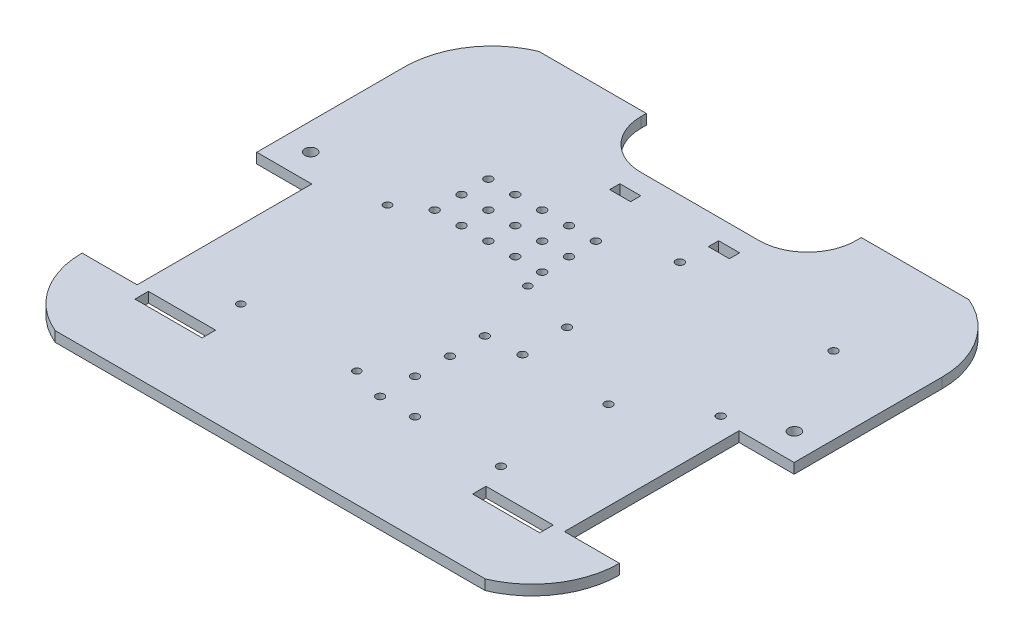
from build123d import *

# Parameters (mm, degrees)
SKETCH1_W           = 254
SKETCH1_H           = 228.6
BOSS_EXTRUDE1_DEPTH = 4.826
SKETCH2_W           = 26.00000007
SKETCH2_H           = 82.55
CUT_EXTRUDE1_DEPTH  = 4.826
CUT_EXTRUDE3_DEPTH  = 4.826
SKETCH7_W           = 50.8
SKETCH7_H           = 25.4
CUT_EXTRUDE5_DEPTH  = 4.826
FILLET9_R           = 22.86
FILLET10_R          = 22.86
CUT_EXTRUDE6_DEPTH  = 4.826
SKETCH9_W           = 31.75
SKETCH9_H           = 6.35
CUT_EXTRUDE7_DEPTH  = 171.929167423
SKETCH11_W          = 9.906
SKETCH11_H          = 4.826
CUT_EXTRUDE8_DEPTH  = 171.929167423
SKETCH13_R          = 1.905
CUT_EXTRUDE10_DEPTH = 171.929167423
SKETCH14_R          = 1.778
CUT_EXTRUDE11_DEPTH = 171.929167423
SKETCH15_R          = 1.905
CUT_EXTRUDE12_DEPTH = 171.929167423
SKETCH16_R          = 1.905
CUT_EXTRUDE13_DEPTH = 171.929167423
SKETCH17_R          = 2.778125
CUT_EXTRUDE14_DEPTH = 171.929167423
SKETCH18_R          = 1.905
CUT_EXTRUDE15_DEPTH = 171.929167423


with BuildPart() as part:
    # Sketch1 → Boss-Extrude1 (new body)
    with BuildSketch(Plane(origin=(0, 0, 0), x_dir=(1, 0, 0), z_dir=(0, 1, 0))):
        Rectangle(SKETCH1_W, SKETCH1_H)
    extrude(amount=BOSS_EXTRUDE1_DEPTH)

    # Sketch2 → Cut-Extrude1 (cut)
    with BuildSketch(Plane(origin=(0, 4.826, 0), x_dir=(1, 0, 0), z_dir=(0, 1, 0))):
        with Locations((-113.999999965, -34.925)):
            Rectangle(SKETCH2_W, SKETCH2_H)
        with Locations((113.999999965, -34.925)):
            Rectangle(SKETCH2_W, SKETCH2_H)
    extrude(amount=-CUT_EXTRUDE1_DEPTH, mode=Mode.SUBTRACT)

    # Sketch4 → Cut-Extrude3 (cut)
    with BuildSketch(Plane(origin=(0, 4.826, 0), x_dir=(1, 0, 0), z_dir=(0, 1, 0))):
        with BuildLine():
            Line((-127, 76.2), (-127, 114.3))
            Line((-127, 114.3), (-101.6, 114.3))
            ThreePointArc((-101.6, 114.3), (-120.067875899, 99.095250599), (-127, 76.2))
        make_face()
        with BuildLine():
            Line((127, 76.2), (127, 114.3))
            Line((127, 114.3), (101.6, 114.3))
            ThreePointArc((101.6, 114.3), (120.067875899, 99.095250599), (127, 76.2))
        make_face()
    extrude(amount=-CUT_EXTRUDE3_DEPTH, mode=Mode.SUBTRACT)

    # Sketch7 → Cut-Extrude5 (cut)
    with BuildSketch(Plane(origin=(0, 4.826, 0), x_dir=(1, 0, 0), z_dir=(0, 1, 0))):
        with Locations((-25.4, 101.6)):
            Rectangle(SKETCH7_W, SKETCH7_H)
        with Locations((25.4, 101.6)):
            Rectangle(SKETCH7_W, SKETCH7_H)
    extrude(amount=-CUT_EXTRUDE5_DEPTH, mode=Mode.SUBTRACT)

    # Fillet9
    fillet9_edges = [part.edges().sort_by_distance(p)[0] for p in [
        (-50.8, 2.413, -88.9),
    ]]
    fillet(fillet9_edges, radius=FILLET9_R)

    # Fillet10
    fillet10_edges = [part.edges().sort_by_distance(p)[0] for p in [
        (50.8, 2.413, -88.9),
    ]]
    fillet(fillet10_edges, radius=FILLET10_R)

    # Sketch8 → Cut-Extrude6 (cut)
    with BuildSketch(Plane(origin=(0, 4.826, 0), x_dir=(1, 0, 0), z_dir=(0, 1, 0))):
        with BuildLine():
            Line((-127, -76.2), (-127, -114.3))
            Line((-127, -114.3), (-101.6, -114.3))
            ThreePointArc((-101.6, -114.3), (-120.067875899, -99.095250599), (-127, -76.2))
        make_face()
        with BuildLine():
            Line((127, -114.3), (101.6, -114.3))
            ThreePointArc((101.6, -114.3), (120.067875899, -99.095250599), (127, -76.2))
            Line((127, -76.2), (127, -114.3))
        make_face()
    extrude(amount=-CUT_EXTRUDE6_DEPTH, mode=Mode.SUBTRACT)

    # Sketch9 → Cut-Extrude7 (cut, through all)
    with BuildSketch(Plane.XZ):
        with Locations((-79.79099993, 79.375)):
            Rectangle(SKETCH9_W, SKETCH9_H)
        with Locations((79.79099993, 79.375)):
            Rectangle(SKETCH9_W, SKETCH9_H)
    extrude(amount=-CUT_EXTRUDE7_DEPTH, mode=Mode.SUBTRACT)

    # Sketch11 → Cut-Extrude8 (cut, through all)
    with BuildSketch(Plane(origin=(0, 4.826, 0), x_dir=(1, 0, 0), z_dir=(0, 1, 0))):
        with Locations((-23.345869789, 76.863822677)):
            Rectangle(SKETCH11_W, SKETCH11_H)
        with Locations((23.345869789, 76.863822677)):
            Rectangle(SKETCH11_W, SKETCH11_H)
    extrude(amount=-CUT_EXTRUDE8_DEPTH, mode=Mode.SUBTRACT)

    # Sketch13 → Cut-Extrude10 (cut, through all)
    with BuildSketch(Plane(origin=(0, 4.826, 0), x_dir=(1, 0, 0), z_dir=(0, 1, 0))):
        with Locations(Location((-10.4749371, 24.715879034, 0), (0, 0, 270))):
            Circle(SKETCH13_R)
        with Locations(Location((-23.1749371, 24.715879034, 0), (0, 0, 270))):
            Circle(SKETCH13_R)
        with Locations(Location((-35.8749371, 24.715879034, 0), (0, 0, 270))):
            Circle(SKETCH13_R)
        with Locations(Location((-48.5749371, 24.715879034, 0), (0, 0, 270))):
            Circle(SKETCH13_R)
        with Locations(Location((-61.2749371, 24.715879034, 0), (0, 0, 270))):
            Circle(SKETCH13_R)
        with Locations(Location((-23.1749371, 37.415879034, 0), (0, 0, 270))):
            Circle(SKETCH13_R)
        with Locations(Location((-35.8749371, 37.415879034, 0), (0, 0, 270))):
            Circle(SKETCH13_R)
        with Locations(Location((-48.5749371, 37.415879034, 0), (0, 0, 270))):
            Circle(SKETCH13_R)
        with Locations(Location((-61.2749371, 37.415879034, 0), (0, 0, 270))):
            Circle(SKETCH13_R)
        with Locations(Location((-23.1749371, 50.115879034, 0), (0, 0, 270))):
            Circle(SKETCH13_R)
        with Locations(Location((-35.8749371, 50.115879034, 0), (0, 0, 270))):
            Circle(SKETCH13_R)
        with Locations(Location((-48.5749371, 50.115879034, 0), (0, 0, 270))):
            Circle(SKETCH13_R)
        with Locations(Location((-61.2749371, 50.115879034, 0), (0, 0, 270))):
            Circle(SKETCH13_R)
        with Locations(Location((-10.4749371, 37.415879034, 0), (0, 0, 270))):
            Circle(SKETCH13_R)
        with Locations(Location((-10.4749371, 50.115879034, 0), (0, 0, 270))):
            Circle(SKETCH13_R)
    extrude(amount=-CUT_EXTRUDE10_DEPTH, mode=Mode.SUBTRACT)

    # Sketch14 → Cut-Extrude11 (cut, through all)
    with BuildSketch(Plane(origin=(0, 4.826, 0), x_dir=(1, 0, 0), z_dir=(0, 1, 0))):
        with Locations(Location((-68.6409371, -59.556843517, 0), (0, 0, 270))):
            Circle(SKETCH14_R)
        with Locations(Location((-13.7769371, -59.556843517, 0), (0, 0, 270))):
            Circle(SKETCH14_R)
        with Locations(Location((-74.4829371, 15.627156483, 0), (0, 0, 270))):
            Circle(SKETCH14_R)
        with Locations(Location((-8.1889371, 15.627156483, 0), (0, 0, 270))):
            Circle(SKETCH14_R)
    extrude(amount=-CUT_EXTRUDE11_DEPTH, mode=Mode.SUBTRACT)

    # Sketch15 → Cut-Extrude12 (cut, through all)
    with BuildSketch(Plane(origin=(0, 4.826, 0), x_dir=(1, 0, 0), z_dir=(0, 1, 0))):
        with Locations(Location((59.276921846, -64.485146072, 0), (0, 0, 270))):
            Circle(SKETCH15_R)
        with Locations(Location((18.636921846, -64.485146072, 0), (0, 0, 270))):
            Circle(SKETCH15_R)
        with Locations(Location((59.276921846, -13.685146072, 0), (0, 0, 270))):
            Circle(SKETCH15_R)
        with Locations(Location((18.636921846, -13.685146072, 0), (0, 0, 270))):
            Circle(SKETCH15_R)
    extrude(amount=-CUT_EXTRUDE12_DEPTH, mode=Mode.SUBTRACT)

    # Sketch16 → Cut-Extrude13 (cut, through all)
    with BuildSketch(Plane(origin=(0, 4.826, 0), x_dir=(1, 0, 0), z_dir=(0, 1, 0))):
        with Locations(Location((90.645921846, 7.99943228, 0), (0, 0, 270))):
            Circle(SKETCH16_R)
        with Locations(Location((18.001921846, 7.99943228, 0), (0, 0, 270))):
            Circle(SKETCH16_R)
        with Locations(Location((18.001921846, 61.33943228, 0), (0, 0, 270))):
            Circle(SKETCH16_R)
        with Locations(Location((90.645921846, 61.33943228, 0), (0, 0, 270))):
            Circle(SKETCH16_R)
    extrude(amount=-CUT_EXTRUDE13_DEPTH, mode=Mode.SUBTRACT)

    # Sketch17 → Cut-Extrude14 (cut, through all)
    with BuildSketch(Plane.XZ):
        with Locations(Location((114.3, -19.164632523, 0), (0, 0, 270))):
            Circle(SKETCH17_R)
        with Locations(Location((-114.3, -19.164632523, 0), (0, 0, 270))):
            Circle(SKETCH17_R)
    extrude(amount=-CUT_EXTRUDE14_DEPTH, mode=Mode.SUBTRACT)

    # Sketch18 → Cut-Extrude15 (cut, through all)
    with BuildSketch(Plane(origin=(0, 4.826, 0), x_dir=(1, 0, 0), z_dir=(0, 1, 0))):
        with Locations(Location((2.126921846, -64.485146072, 0), (0, 0, 270))):
            Circle(SKETCH18_R)
        with Locations(Location((2.126921846, -47.975146072, 0), (0, 0, 270))):
            Circle(SKETCH18_R)
        with Locations(Location((2.126921846, -31.465146072, 0), (0, 0, 270))):
            Circle(SKETCH18_R)
        with Locations(Location((2.126921846, -14.955146072, 0), (0, 0, 270))):
            Circle(SKETCH18_R)
    extrude(amount=-CUT_EXTRUDE15_DEPTH, mode=Mode.SUBTRACT)


solid = part.part
